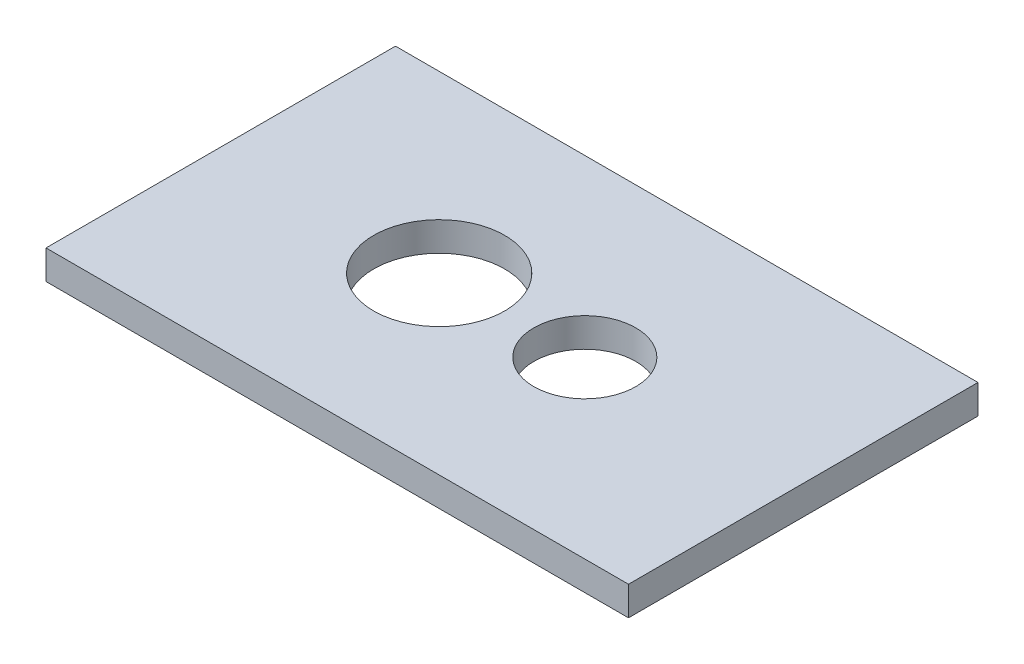
from build123d import *

# Parameters (mm, degrees)
SKETCH1_W           = 127
SKETCH1_H           = 76.2
BOSS_EXTRUDE1_DEPTH = 6.35
SKETCH3_R           = 14.2875
CUT_EXTRUDE1_DEPTH  = 75.324844433
SKETCH4_R           = 11.1125
CUT_EXTRUDE2_DEPTH  = 75.324844433


with BuildPart() as part:
    # Sketch1 → Boss-Extrude1 (new body)
    with BuildSketch(Plane(origin=(0, 0, 0), x_dir=(1, 0, 0), z_dir=(0, 1, 0))):
        Rectangle(SKETCH1_W, SKETCH1_H)
    extrude(amount=BOSS_EXTRUDE1_DEPTH)

    # Sketch3 → Cut-Extrude1 (cut, through all)
    with BuildSketch(Plane(origin=(0, 6.35, 0), x_dir=(1, 0, 0), z_dir=(0, 1, 0))):
        with Locations(Location((-15.875, 0, 0), (0, 0, 270))):
            Circle(SKETCH3_R)
    extrude(amount=-CUT_EXTRUDE1_DEPTH, mode=Mode.SUBTRACT)

    # Sketch4 → Cut-Extrude2 (cut, through all)
    with BuildSketch(Plane(origin=(0, 6.35, 0), x_dir=(1, 0, 0), z_dir=(0, 1, 0))):
        with Locations(Location((15.875, 0, 0), (0, 0, 270))):
            Circle(SKETCH4_R)
    extrude(amount=-CUT_EXTRUDE2_DEPTH, mode=Mode.SUBTRACT)


solid = part.part
